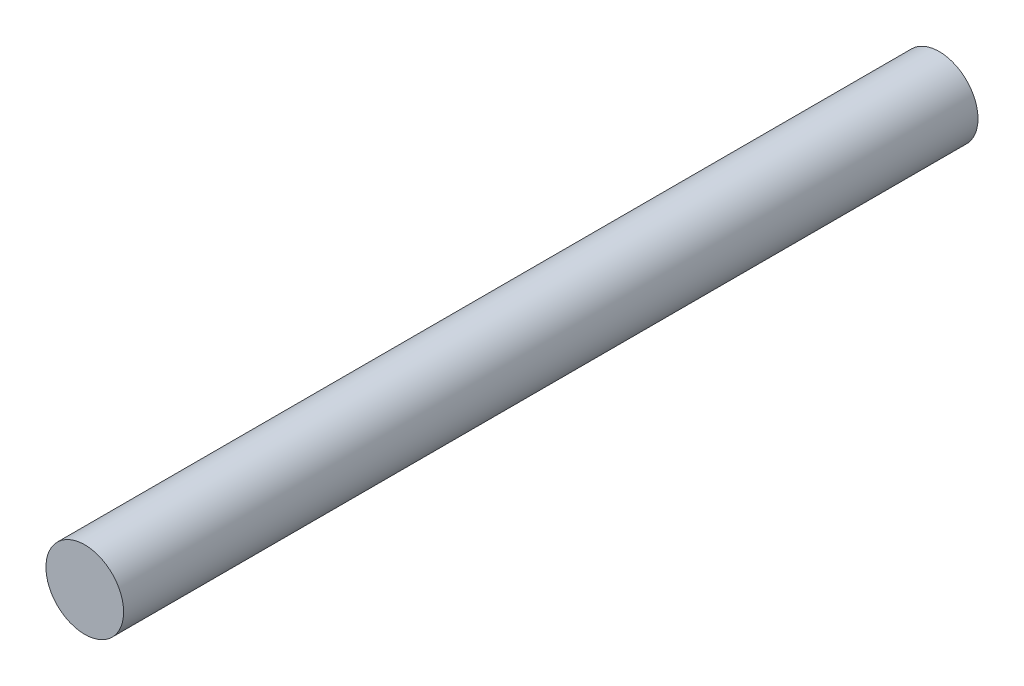
from build123d import *

# Parameters (mm, degrees)
SKETCH_1_R      = 5
EXTRUDE_1_DEPTH = 110


with BuildPart() as part:
    # 草图1 → 凸台-拉伸1 (new body)
    with BuildSketch(Plane.XY):
        Circle(SKETCH_1_R)
    extrude(amount=EXTRUDE_1_DEPTH)


solid = part.part
